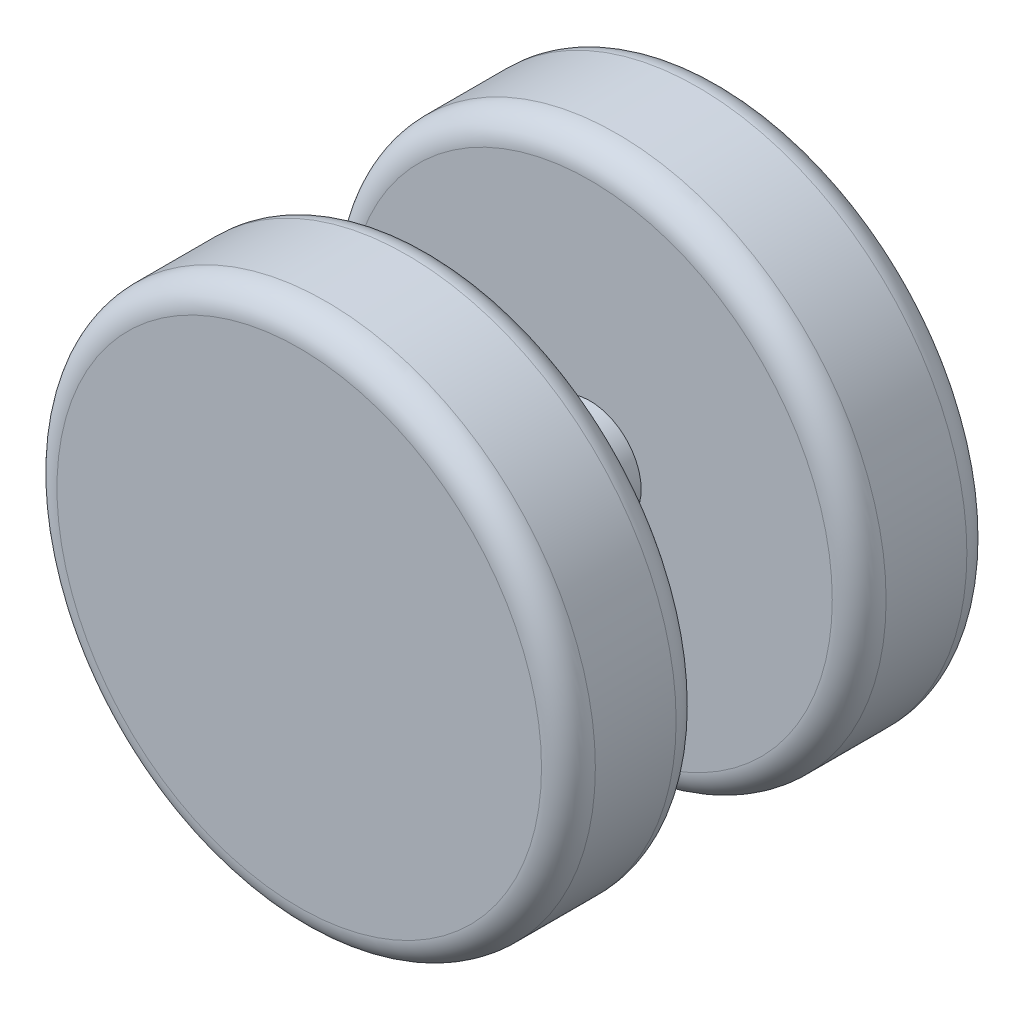
from build123d import *

# Parameters (mm, degrees)
SKETCH1_R           = 5
BOSS_EXTRUDE1_DEPTH = 2.5
FILLET1_R           = 0.5
FILLET2_R           = 0.5
SKETCH2_R           = 0.95
BOSS_EXTRUDE2_DEPTH = 2.9
SKETCH3_R           = 5
BOSS_EXTRUDE3_DEPTH = 2.5
FILLET3_R           = 0.5


with BuildPart() as part:
    # Sketch1 → Boss-Extrude1 (new body)
    with BuildSketch(Plane.XY):
        Circle(SKETCH1_R)
    extrude(amount=BOSS_EXTRUDE1_DEPTH)

    # Fillet1
    fillet1_edges = [part.edges().sort_by_distance(p)[0] for p in [
        (-5, 0, 0),
    ]]
    fillet(fillet1_edges, radius=FILLET1_R)

    # Fillet2
    fillet2_edges = [part.edges().sort_by_distance(p)[0] for p in [
        (-5, 0, 2.5),
    ]]
    fillet(fillet2_edges, radius=FILLET2_R)

    # Sketch2 → Boss-Extrude2 (add)
    with BuildSketch(Plane.XY.offset(2.5)):
        Circle(SKETCH2_R)
    extrude(amount=BOSS_EXTRUDE2_DEPTH)

    # Sketch3 → Boss-Extrude3 (add)
    with BuildSketch(Plane.XY.offset(5.4)):
        Circle(SKETCH3_R)
    extrude(amount=BOSS_EXTRUDE3_DEPTH)

    # Fillet3
    fillet3_edges = [part.edges().sort_by_distance(p)[0] for p in [
        (-5, 0, 5.4),
        (-5, 0, 7.9),
    ]]
    fillet(fillet3_edges, radius=FILLET3_R)


solid = part.part
